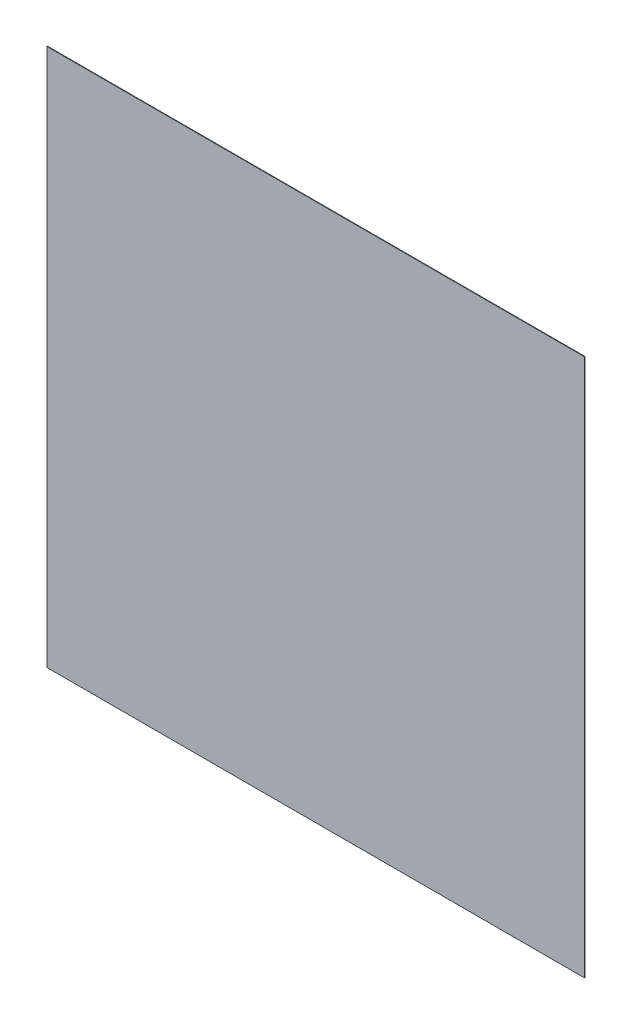
from build123d import *

# Parameters (mm, degrees)
SKETCH_1_W      = 10000
SKETCH_1_H      = 10000
EXTRUDE_1_DEPTH = 10


with BuildPart() as part:
    # 草图1 → 凸台-拉伸1 (new body)
    with BuildSketch(Plane.XY):
        with Locations((5000, 5000)):
            Rectangle(SKETCH_1_W, SKETCH_1_H)
    extrude(amount=EXTRUDE_1_DEPTH)


solid = part.part
